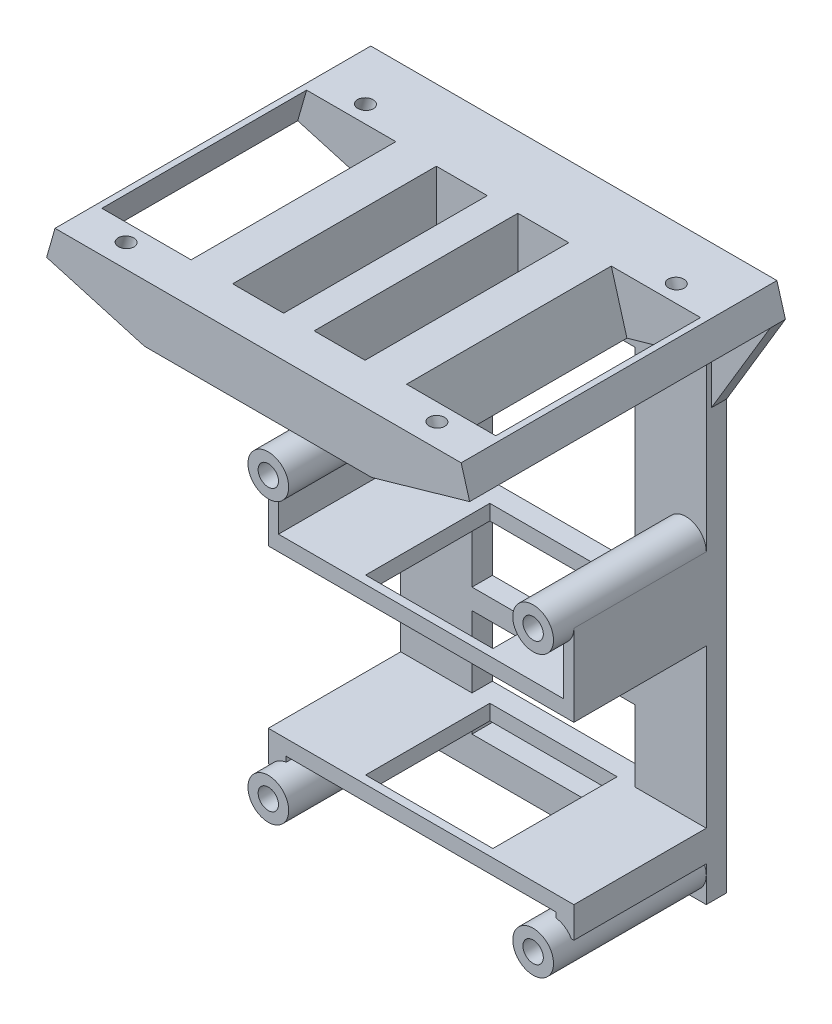
from build123d import *

# Parameters (mm, degrees)
EXTRUDE_1_DEPTH      = 2
EXTRUDE_2_DEPTH      = 29
EXTRUDE_2_DEPTH_BACK = 2
CUT_EXTRUDE_5_REACH  = 63.117
SKETCH_3_R           = 0.75
SKETCH_3_W           = 9
SKETCH_3_H           = 20.1
CUT_EXTRUDE_7_REACH  = 63.924
SKETCH_12_R          = 0.75
SKETCH_12_W          = 9
SKETCH_12_H          = 20.1
CUT_EXTRUDE_8_REACH  = 75.269
SKETCH_13_R          = 1
SKETCH_13_W          = 16
SKETCH_13_H          = 40.897450577
EXTRUDE_START        = 15
SKETCH_15_R          = 2
SKETCH_15_R_2        = 1
EXTRUDE_9_DEPTH      = 15
CUT_EXTRUDE_9_REACH  = 63.508
SKETCH_16_W          = 5
SKETCH_16_H          = 20
EXTRUDE_10_DEPTH     = 24.1
EXTRUDE_11_DEPTH     = 1.5
CUT_EXTRUDE_10_REACH = 75.269
SKETCH_20_W          = 30
SKETCH_20_H          = 1.5
EXTRUDE_12_DEPTH     = 15
SKETCH_21_W          = 16
SKETCH_21_H          = 2
EXTRUDE_13_DEPTH     = 2
SKETCH_22_W          = 1
SKETCH_22_H          = 8
SKETCH_22_W_2        = 1.757464375
SKETCH_22_H_2        = 1.5298575
EXTRUDE_14_DEPTH     = 13
CUT_EXTRUDE_11_REACH = 64.018
SKETCH_23_W          = 12.5
SKETCH_23_H          = 12.2


with BuildPart() as part:
    # 草圖1 → 填料-伸長1 (new body)
    with BuildSketch(Plane.XY):
        Polygon((-15, 0), (15, 0), (17.19885826, 0), (20.767570176, -12.346175865), (15, -14), (15, -64), (-15, -64), (-15, -14), (-20.767570176, -12.346175865), (-17.227361215, 0), align=None)
    extrude(amount=EXTRUDE_1_DEPTH)

    # 草圖2 → 填料-伸長2 (add, two sides: drawn at the far end of the back side and taken through both)
    with BuildSketch(Plane.XY.offset(2).offset(-EXTRUDE_2_DEPTH_BACK)):
        Polygon((-19.940658108, -9.462390777), (19.934511943, -9.464160254), (20.767570176, -12.346175865), (11.154953216, -15.102549423), (-11.154953216, -15.102549423), (-20.767570176, -12.346175865), align=None)
    extrude(amount=EXTRUDE_2_DEPTH + EXTRUDE_2_DEPTH_BACK)

    # 草圖3 → 除料-伸長5 (cut, up to next)
    with BuildSketch(Plane(origin=(3.55693642, -17.281245681, 0), x_dir=(0.9612616959383193, 0.2756373558169973, 0), z_dir=(-0.2756373558169973, 0.9612616959383194, 0)), mode=Mode.PRIVATE) as cut_extrude_5_sk1:
        with Locations((13.397816779, -5.2)):
            Circle(SKETCH_3_R)
    cut_extrude_5_tool1 = extrude(cut_extrude_5_sk1.sketch, amount=CUT_EXTRUDE_5_REACH, mode=Mode.PRIVATE) & part.part
    # 草圖3 → 除料-伸長5 (cut, up to next)
    with BuildSketch(Plane(origin=(3.55693642, -17.281245681, 0), x_dir=(0.9612616959383193, 0.2756373558169973, 0), z_dir=(-0.2756373558169973, 0.9612616959383194, 0)), mode=Mode.PRIVATE) as cut_extrude_5_sk2:
        with Locations((13.397816779, -28.7)):
            Circle(SKETCH_3_R)
    cut_extrude_5_tool2 = extrude(cut_extrude_5_sk2.sketch, amount=CUT_EXTRUDE_5_REACH, mode=Mode.PRIVATE) & part.part
    # 草圖3 → 除料-伸長5 (cut, up to next)
    with BuildSketch(Plane(origin=(3.55693642, -17.281245681, 0), x_dir=(0.9612616959383193, 0.2756373558169973, 0), z_dir=(-0.2756373558169973, 0.9612616959383194, 0)), mode=Mode.PRIVATE) as cut_extrude_5_sk3:
        with Locations((13.397816779, -16.95)):
            Rectangle(SKETCH_3_W, SKETCH_3_H)
    cut_extrude_5_tool3 = extrude(cut_extrude_5_sk3.sketch, amount=CUT_EXTRUDE_5_REACH, mode=Mode.PRIVATE) & part.part
    add(cut_extrude_5_tool1.solids().sort_by_distance((16.435744, -13.588307, 5.2))[0], mode=Mode.SUBTRACT)
    add(cut_extrude_5_tool2.solids().sort_by_distance((16.435744, -13.588307, 28.7))[0], mode=Mode.SUBTRACT)
    add(cut_extrude_5_tool3.solids().sort_by_distance((16.435744, -13.588307, 16.95))[0], mode=Mode.SUBTRACT)

    # 除料-伸長7: up to this plane
    cut_extrude_7_end = Plane(origin=(-19.940658108, -9.462390777, 0), z_dir=(4.437541139610382e-05, 0.9999999990154116, 0))
    # 草圖12 → 除料-伸長7 (cut, up to the surface)
    with BuildSketch(Plane(origin=(-4.849074128, -16.910731155, 0), x_dir=(0.9612616959383179, -0.2756373558170027, 0), z_dir=(-0.2756373558170027, -0.9612616959383179, 0)), mode=Mode.PRIVATE) as cut_extrude_7_sk1:
        with Locations((-12.060002458, 28.7)):
            Circle(SKETCH_12_R)
    cut_extrude_7_tool1 = split(extrude(cut_extrude_7_sk1.sketch, amount=-CUT_EXTRUDE_7_REACH, mode=Mode.PRIVATE), bisect_by=cut_extrude_7_end, keep=Keep.BOTH, mode=Mode.PRIVATE)
    add(cut_extrude_7_tool1.solids().sort_by_distance((-16.441893, -13.586544, 28.7))[0], mode=Mode.SUBTRACT)
    # 草圖12 → 除料-伸長7 (cut, up to the surface)
    with BuildSketch(Plane(origin=(-4.849074128, -16.910731155, 0), x_dir=(0.9612616959383179, -0.2756373558170027, 0), z_dir=(-0.2756373558170027, -0.9612616959383179, 0)), mode=Mode.PRIVATE) as cut_extrude_7_sk2:
        with Locations((-12.060002458, 5.2)):
            Circle(SKETCH_12_R)
    cut_extrude_7_tool2 = split(extrude(cut_extrude_7_sk2.sketch, amount=-CUT_EXTRUDE_7_REACH, mode=Mode.PRIVATE), bisect_by=cut_extrude_7_end, keep=Keep.BOTH, mode=Mode.PRIVATE)
    add(cut_extrude_7_tool2.solids().sort_by_distance((-16.441893, -13.586544, 5.2))[0], mode=Mode.SUBTRACT)
    # 草圖12 → 除料-伸長7 (cut, up to the surface)
    with BuildSketch(Plane(origin=(-4.849074128, -16.910731155, 0), x_dir=(0.9612616959383179, -0.2756373558170027, 0), z_dir=(-0.2756373558170027, -0.9612616959383179, 0)), mode=Mode.PRIVATE) as cut_extrude_7_sk3:
        with Locations((-12.060002458, 16.95)):
            Rectangle(SKETCH_12_W, SKETCH_12_H)
    cut_extrude_7_tool3 = split(extrude(cut_extrude_7_sk3.sketch, amount=-CUT_EXTRUDE_7_REACH, mode=Mode.PRIVATE), bisect_by=cut_extrude_7_end, keep=Keep.BOTH, mode=Mode.PRIVATE)
    add(cut_extrude_7_tool3.solids().sort_by_distance((-16.441893, -13.586544, 16.95))[0], mode=Mode.SUBTRACT)

    # 草圖13 → 除料-伸長8 (cut, up to next)
    with BuildSketch(Plane.XY.offset(2), mode=Mode.PRIVATE) as cut_extrude_8_sk1:
        with Locations((-13, -34)):
            Circle(SKETCH_13_R)
    cut_extrude_8_tool1 = extrude(cut_extrude_8_sk1.sketch, amount=-CUT_EXTRUDE_8_REACH, mode=Mode.PRIVATE) & part.part
    # 草圖13 → 除料-伸長8 (cut, up to next)
    with BuildSketch(Plane.XY.offset(2), mode=Mode.PRIVATE) as cut_extrude_8_sk2:
        with Locations((13, -34)):
            Circle(SKETCH_13_R)
    cut_extrude_8_tool2 = extrude(cut_extrude_8_sk2.sketch, amount=-CUT_EXTRUDE_8_REACH, mode=Mode.PRIVATE) & part.part
    # 草圖13 → 除料-伸長8 (cut, up to next)
    with BuildSketch(Plane.XY.offset(2), mode=Mode.PRIVATE) as cut_extrude_8_sk3:
        with Locations((-13, -61.5)):
            Circle(SKETCH_13_R)
    cut_extrude_8_tool3 = extrude(cut_extrude_8_sk3.sketch, amount=-CUT_EXTRUDE_8_REACH, mode=Mode.PRIVATE) & part.part
    # 草圖13 → 除料-伸長8 (cut, up to next)
    with BuildSketch(Plane.XY.offset(2), mode=Mode.PRIVATE) as cut_extrude_8_sk4:
        with Locations((13, -61.5)):
            Circle(SKETCH_13_R)
    cut_extrude_8_tool4 = extrude(cut_extrude_8_sk4.sketch, amount=-CUT_EXTRUDE_8_REACH, mode=Mode.PRIVATE) & part.part
    # 草圖13 → 除料-伸長8 (cut, up to next)
    with BuildSketch(Plane.XY.offset(2), mode=Mode.PRIVATE) as cut_extrude_8_sk5:
        with Locations((0, -40.551274712)):
            Rectangle(SKETCH_13_W, SKETCH_13_H)
    cut_extrude_8_tool5 = extrude(cut_extrude_8_sk5.sketch, amount=-CUT_EXTRUDE_8_REACH, mode=Mode.PRIVATE) & part.part
    add(cut_extrude_8_tool1.solids().sort_by_distance((-13, -34, 2))[0], mode=Mode.SUBTRACT)
    add(cut_extrude_8_tool2.solids().sort_by_distance((13, -34, 2))[0], mode=Mode.SUBTRACT)
    add(cut_extrude_8_tool3.solids().sort_by_distance((-13, -61.5, 2))[0], mode=Mode.SUBTRACT)
    add(cut_extrude_8_tool4.solids().sort_by_distance((13, -61.5, 2))[0], mode=Mode.SUBTRACT)
    add(cut_extrude_8_tool5.solids().sort_by_distance((0, -40.551275, 2))[0], mode=Mode.SUBTRACT)

    # 草圖15 → 填料-伸長9 (add)
    # profile 1 of 4: a face of its own
    with BuildSketch(Plane.XY.offset(2).offset(EXTRUDE_START)):
        with Locations(Location((-13, -34, 0), (0, 0, 180))):
            Circle(SKETCH_15_R)
        with Locations((-13, -34)):
            Circle(SKETCH_15_R_2, mode=Mode.SUBTRACT)
    # profile 2 of 4: a face of its own
    with BuildSketch(Plane.XY.offset(2).offset(EXTRUDE_START)):
        with Locations((13, -34)):
            Circle(SKETCH_15_R)
        with Locations((13, -34)):
            Circle(SKETCH_15_R_2, mode=Mode.SUBTRACT)
    # profile 3 of 4: a face of its own
    with BuildSketch(Plane.XY.offset(2).offset(EXTRUDE_START)):
        with Locations((13, -61.5)):
            Circle(SKETCH_15_R)
        with Locations((13, -61.5)):
            Circle(SKETCH_15_R_2, mode=Mode.SUBTRACT)
    # profile 4 of 4: a face of its own
    with BuildSketch(Plane.XY.offset(2).offset(EXTRUDE_START)):
        with Locations(Location((-13, -61.5, 0), (0, 0, 180))):
            Circle(SKETCH_15_R)
        with Locations((-13, -61.5)):
            Circle(SKETCH_15_R_2, mode=Mode.SUBTRACT)
    extrude(amount=-EXTRUDE_9_DEPTH)

    # 草圖16 → 除料-伸長9 (cut, up to next)
    with BuildSketch(Plane.XZ.offset(15.102549423), mode=Mode.PRIVATE) as cut_extrude_9_sk1:
        with Locations((-4, 17)):
            Rectangle(SKETCH_16_W, SKETCH_16_H)
    cut_extrude_9_tool1 = extrude(cut_extrude_9_sk1.sketch, amount=-CUT_EXTRUDE_9_REACH, mode=Mode.PRIVATE) & part.part
    # 草圖16 → 除料-伸長9 (cut, up to next)
    with BuildSketch(Plane.XZ.offset(15.102549423), mode=Mode.PRIVATE) as cut_extrude_9_sk2:
        with Locations((4, 17)):
            Rectangle(SKETCH_16_W, SKETCH_16_H)
    cut_extrude_9_tool2 = extrude(cut_extrude_9_sk2.sketch, amount=-CUT_EXTRUDE_9_REACH, mode=Mode.PRIVATE) & part.part
    add(cut_extrude_9_tool1.solids().sort_by_distance((-4, -15.102549, 17))[0], mode=Mode.SUBTRACT)
    add(cut_extrude_9_tool2.solids().sort_by_distance((4, -15.102549, 17))[0], mode=Mode.SUBTRACT)

    # 草圖17 → 填料-伸長10 (add)
    with BuildSketch(Plane.XY.offset(31)):
        Polygon((-19.940658108, -9.462390777), (-20.767570176, -12.346175865), (-20.213148693, -12.505153667), (-19.340658109, -9.462417403), align=None)
        Polygon((19.334511943, -9.464133629), (19.934511943, -9.464160254), (20.767570176, -12.346175865), (20.207014757, -12.506912545), align=None)
    extrude(amount=-EXTRUDE_10_DEPTH)

    # 草圖18 → 填料-伸長11 (add)
    with BuildSketch(Plane(origin=(0, 0, 0), x_dir=(-1, 0, 0), z_dir=(0, 0, -1))):
        Polygon((-20.767570176, -12.346175865), (-15, -22), (-15, -14), align=None)
        Polygon((20.767570176, -12.346175865), (15, -14), (15, -22), align=None)
    extrude(amount=-EXTRUDE_11_DEPTH)

    # 草圖19 → 除料-伸長10 (cut, up to next)
    with BuildSketch(Plane.XY.offset(2), mode=Mode.PRIVATE) as cut_extrude_10_sk1:
        Polygon((-19.940658108, -9.462390777), (19.934511943, -9.464160254), (19.934511943, 2.341545169), (-19.940658108, 2.341545169), align=None)
    cut_extrude_10_tool1 = extrude(cut_extrude_10_sk1.sketch, amount=-CUT_EXTRUDE_10_REACH, mode=Mode.PRIVATE) & part.part
    add(cut_extrude_10_tool1.solids().sort_by_distance((-0.002575, -3.560865, 2))[0], mode=Mode.SUBTRACT)

    # 草圖20 → 填料-伸長12 (add)
    with BuildSketch(Plane(origin=(0, 0, 0), x_dir=(-1, 0, 0), z_dir=(0, 0, -1))):
        with Locations((0, -58.25)):
            Rectangle(SKETCH_20_W, SKETCH_20_H)
        with Locations((0, -41.25)):
            Rectangle(SKETCH_20_W, SKETCH_20_H)
    extrude(amount=-EXTRUDE_12_DEPTH)

    # 草圖21 → 填料-伸長13 (add)
    with BuildSketch(Plane(origin=(0, 0, 0), x_dir=(-1, 0, 0), z_dir=(0, 0, -1))):
        with Locations((0, -49.5)):
            Rectangle(SKETCH_21_W, SKETCH_21_H)
    extrude(amount=-EXTRUDE_13_DEPTH)

    # 草圖22 → 填料-伸長14 (add)
    with BuildSketch(Plane.XY.offset(15)):
        with Locations((14.5, -38)):
            Rectangle(SKETCH_22_W, SKETCH_22_H)
        with Locations((-14.5, -38)):
            Rectangle(SKETCH_22_W, SKETCH_22_H)
        with Locations((14.121267813, -59.76492875)):
            Rectangle(SKETCH_22_W_2, SKETCH_22_H_2)
        with Locations((-14.121267813, -59.76492875)):
            Rectangle(SKETCH_22_W_2, SKETCH_22_H_2)
    extrude(amount=-EXTRUDE_14_DEPTH)

    # 除料-伸長11: up to this face of the body (flat: up to its plane)
    cut_extrude_11_end = Plane(part.part.faces().sort_by_distance((0, -40.5, 7.893939394))[0])
    # 草圖23 → 除料-伸長11 (cut, up to the picked face)
    with BuildSketch(Plane.XZ.offset(59), mode=Mode.PRIVATE) as cut_extrude_11_sk1:
        with Locations((0, 8.1)):
            Rectangle(SKETCH_23_W, SKETCH_23_H)
    cut_extrude_11_tool1 = split(extrude(cut_extrude_11_sk1.sketch, amount=-CUT_EXTRUDE_11_REACH, mode=Mode.PRIVATE), bisect_by=cut_extrude_11_end, keep=Keep.BOTH, mode=Mode.PRIVATE)
    add(cut_extrude_11_tool1.solids().sort_by(Axis((0, -59, 8.1), (0, 1, 0)))[0], mode=Mode.SUBTRACT)


solid = part.part
